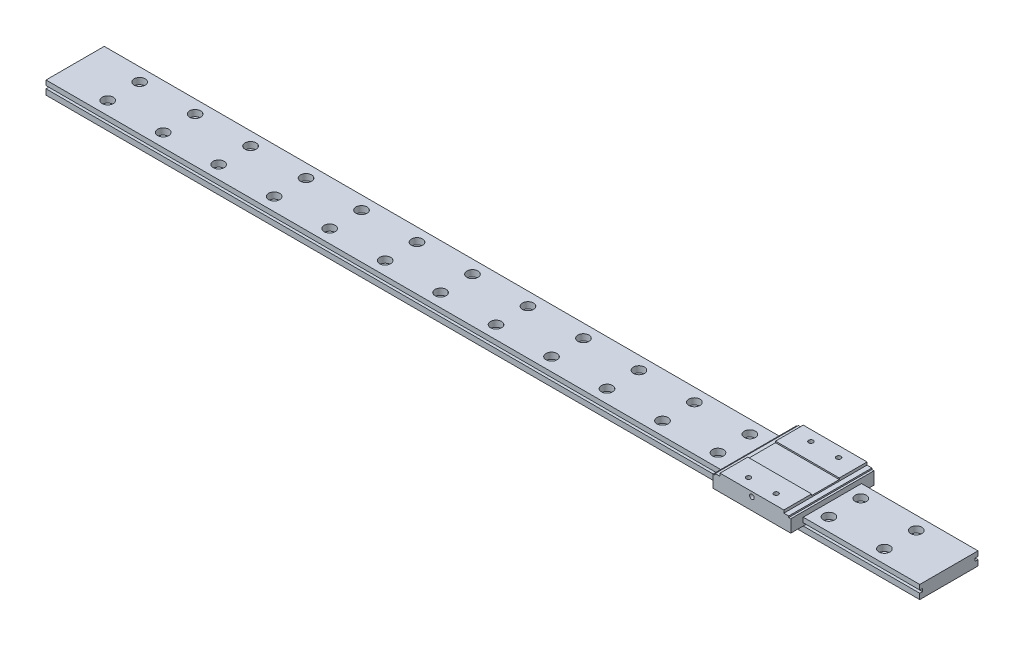
from build123d import *

# Parameters (mm, degrees)
SKETCH_1_W             = 630
SKETCH_1_H             = 42
EXTRUDE_1_DEPTH        = 9.5
SKETCH_2_R             = 4
CUT_EXTRUDE_1_DEPTH    = 4.5
SKETCH_3_R             = 2.25
CUT_EXTRUDE_2_DEPTH    = 632.418244906
SKETCH_16_W            = 5.144238896
SKETCH_16_H            = 2
SKETCH_16_W_2          = 7.201213672
CUT_EXTRUDE_6_DEPTH    = 632.469912189
SKETCH_6_W             = 56
SKETCH_6_H             = 60
EXTRUDE_2_DEPTH        = 12
HOLE_WIZARD_M4_1_D     = 3.3
HOLE_WIZARD_M4_1_DEPTH = 7
HOLE_WIZARD_M4_1_TIP   = 0.991420021
SKETCH_9_W             = 5
SKETCH_9_H             = 60
CUT_EXTRUDE_3_DEPTH    = 2
SKETCH_10_W            = 46
SKETCH_10_H            = 20
CUT_EXTRUDE_4_DEPTH    = 1
SKETCH_11_W            = 1.5
SKETCH_11_H            = 60
CUT_EXTRUDE_5_DEPTH    = 1
HOLE_WIZARD_M4_2_D     = 3.3


with BuildPart() as part:
    # 스케치1 → 보스-돌출1 (new body)
    with BuildSketch(Plane(origin=(0, 0, 0), x_dir=(1, 0, 0), z_dir=(0, 1, 0))):
        with Locations((315, 21)):
            Rectangle(SKETCH_1_W, SKETCH_1_H)
    extrude(amount=EXTRUDE_1_DEPTH)

    # 스케치2 → 컷-돌출1 (cut)
    with BuildSketch(Plane(origin=(0, 9.5, 0), x_dir=(1, 0, 0), z_dir=(0, 1, 0))):
        with Locations(Location((35, 32.5, 0), (0, 0, 270))):
            Circle(SKETCH_2_R)
        with Locations(Location((35, 9.5, 0), (0, 0, 270))):
            Circle(SKETCH_2_R)
        with Locations(Location((75, 32.5, 0), (0, 0, 270))):
            Circle(SKETCH_2_R)
        with Locations(Location((75, 9.5, 0), (0, 0, 270))):
            Circle(SKETCH_2_R)
        with Locations(Location((115, 32.5, 0), (0, 0, 270))):
            Circle(SKETCH_2_R)
        with Locations(Location((115, 9.5, 0), (0, 0, 270))):
            Circle(SKETCH_2_R)
        with Locations(Location((155, 32.5, 0), (0, 0, 270))):
            Circle(SKETCH_2_R)
        with Locations(Location((155, 9.5, 0), (0, 0, 270))):
            Circle(SKETCH_2_R)
        with Locations(Location((195, 32.5, 0), (0, 0, 270))):
            Circle(SKETCH_2_R)
        with Locations(Location((195, 9.5, 0), (0, 0, 270))):
            Circle(SKETCH_2_R)
        with Locations(Location((235, 32.5, 0), (0, 0, 270))):
            Circle(SKETCH_2_R)
        with Locations(Location((235, 9.5, 0), (0, 0, 270))):
            Circle(SKETCH_2_R)
        with Locations(Location((275, 32.5, 0), (0, 0, 270))):
            Circle(SKETCH_2_R)
        with Locations(Location((275, 9.5, 0), (0, 0, 270))):
            Circle(SKETCH_2_R)
        with Locations(Location((315, 32.5, 0), (0, 0, 270))):
            Circle(SKETCH_2_R)
        with Locations(Location((315, 9.5, 0), (0, 0, 270))):
            Circle(SKETCH_2_R)
        with Locations(Location((355, 32.5, 0), (0, 0, 270))):
            Circle(SKETCH_2_R)
        with Locations(Location((355, 9.5, 0), (0, 0, 270))):
            Circle(SKETCH_2_R)
        with Locations(Location((395, 32.5, 0), (0, 0, 270))):
            Circle(SKETCH_2_R)
        with Locations(Location((395, 9.5, 0), (0, 0, 270))):
            Circle(SKETCH_2_R)
        with Locations(Location((435, 32.5, 0), (0, 0, 270))):
            Circle(SKETCH_2_R)
        with Locations(Location((435, 9.5, 0), (0, 0, 270))):
            Circle(SKETCH_2_R)
        with Locations(Location((475, 32.5, 0), (0, 0, 270))):
            Circle(SKETCH_2_R)
        with Locations(Location((475, 9.5, 0), (0, 0, 270))):
            Circle(SKETCH_2_R)
        with Locations(Location((515, 32.5, 0), (0, 0, 270))):
            Circle(SKETCH_2_R)
        with Locations(Location((515, 9.5, 0), (0, 0, 270))):
            Circle(SKETCH_2_R)
        with Locations(Location((555, 32.5, 0), (0, 0, 270))):
            Circle(SKETCH_2_R)
        with Locations(Location((555, 9.5, 0), (0, 0, 270))):
            Circle(SKETCH_2_R)
        with Locations(Location((595, 32.5, 0), (0, 0, 270))):
            Circle(SKETCH_2_R)
        with Locations(Location((595, 9.5, 0), (0, 0, 270))):
            Circle(SKETCH_2_R)
    extrude(amount=-CUT_EXTRUDE_1_DEPTH, mode=Mode.SUBTRACT)

    # 스케치3 → 컷-돌출2 (cut, through all)
    with BuildSketch(Plane(origin=(0, 5, 0), x_dir=(1, 0, 0), z_dir=(0, 1, 0))):
        with Locations(Location((35, 32.5, 0), (0, 0, 270))):
            Circle(SKETCH_3_R)
        with Locations(Location((35, 9.5, 0), (0, 0, 270))):
            Circle(SKETCH_3_R)
        with Locations(Location((75, 32.5, 0), (0, 0, 270))):
            Circle(SKETCH_3_R)
        with Locations(Location((75, 9.5, 0), (0, 0, 270))):
            Circle(SKETCH_3_R)
        with Locations(Location((115, 32.5, 0), (0, 0, 270))):
            Circle(SKETCH_3_R)
        with Locations(Location((115, 9.5, 0), (0, 0, 270))):
            Circle(SKETCH_3_R)
        with Locations(Location((155, 32.5, 0), (0, 0, 270))):
            Circle(SKETCH_3_R)
        with Locations(Location((155, 9.5, 0), (0, 0, 270))):
            Circle(SKETCH_3_R)
        with Locations(Location((195, 32.5, 0), (0, 0, 270))):
            Circle(SKETCH_3_R)
        with Locations(Location((195, 9.5, 0), (0, 0, 270))):
            Circle(SKETCH_3_R)
        with Locations(Location((235, 32.5, 0), (0, 0, 270))):
            Circle(SKETCH_3_R)
        with Locations(Location((235, 9.5, 0), (0, 0, 270))):
            Circle(SKETCH_3_R)
        with Locations(Location((275, 32.5, 0), (0, 0, 270))):
            Circle(SKETCH_3_R)
        with Locations(Location((275, 9.5, 0), (0, 0, 270))):
            Circle(SKETCH_3_R)
        with Locations(Location((315, 32.5, 0), (0, 0, 270))):
            Circle(SKETCH_3_R)
        with Locations(Location((315, 9.5, 0), (0, 0, 270))):
            Circle(SKETCH_3_R)
        with Locations(Location((355, 32.5, 0), (0, 0, 270))):
            Circle(SKETCH_3_R)
        with Locations(Location((355, 9.5, 0), (0, 0, 270))):
            Circle(SKETCH_3_R)
        with Locations(Location((395, 32.5, 0), (0, 0, 270))):
            Circle(SKETCH_3_R)
        with Locations(Location((395, 9.5, 0), (0, 0, 270))):
            Circle(SKETCH_3_R)
        with Locations(Location((435, 32.5, 0), (0, 0, 270))):
            Circle(SKETCH_3_R)
        with Locations(Location((435, 9.5, 0), (0, 0, 270))):
            Circle(SKETCH_3_R)
        with Locations(Location((475, 32.5, 0), (0, 0, 270))):
            Circle(SKETCH_3_R)
        with Locations(Location((475, 9.5, 0), (0, 0, 270))):
            Circle(SKETCH_3_R)
        with Locations(Location((515, 32.5, 0), (0, 0, 270))):
            Circle(SKETCH_3_R)
        with Locations(Location((515, 9.5, 0), (0, 0, 270))):
            Circle(SKETCH_3_R)
        with Locations(Location((555, 32.5, 0), (0, 0, 270))):
            Circle(SKETCH_3_R)
        with Locations(Location((555, 9.5, 0), (0, 0, 270))):
            Circle(SKETCH_3_R)
        with Locations(Location((595, 32.5, 0), (0, 0, 270))):
            Circle(SKETCH_3_R)
        with Locations(Location((595, 9.5, 0), (0, 0, 270))):
            Circle(SKETCH_3_R)
    extrude(amount=-CUT_EXTRUDE_2_DEPTH, mode=Mode.SUBTRACT)

    # 스케치16 → 컷-돌출6 (cut, through all)
    with BuildSketch(Plane(origin=(630, 0, 0), x_dir=(0, 0, -1), z_dir=(1, 0, 0))):
        with Locations((-0.572119448, 5)):
            Rectangle(SKETCH_16_W, SKETCH_16_H)
        with Locations((43.600606836, 5)):
            Rectangle(SKETCH_16_W_2, SKETCH_16_H)
    extrude(amount=-CUT_EXTRUDE_6_DEPTH, mode=Mode.SUBTRACT)

    # 스케치6 → 보스-돌출2 (add)
    with BuildSketch(Plane(origin=(0, 4, 0), x_dir=(-1, 0, 0), z_dir=(0, -1, 0))):
        with Locations((-518, 21)):
            Rectangle(SKETCH_6_W, SKETCH_6_H)
    extrude(amount=-EXTRUDE_2_DEPTH)

    # M4 나사 구멍1
    with Locations(Plane(origin=(0, 16, 0), x_dir=(1, 0, 0), z_dir=(0, 1, 0))):
        with Locations((508, 43.5), (528, 43.5), (508, -1.5), (528, -1.5)):
            Hole(HOLE_WIZARD_M4_1_D / 2, depth=HOLE_WIZARD_M4_1_DEPTH)
            with Locations((0, 0, -(HOLE_WIZARD_M4_1_DEPTH + HOLE_WIZARD_M4_1_TIP / 2))):  # 118° drill point
                Cone(0, HOLE_WIZARD_M4_1_D / 2, HOLE_WIZARD_M4_1_TIP, mode=Mode.SUBTRACT)

    # 스케치9 → 컷-돌출3 (cut)
    with BuildSketch(Plane(origin=(0, 16, 0), x_dir=(1, 0, 0), z_dir=(0, 1, 0))):
        with Locations((492.5, 21)):
            Rectangle(SKETCH_9_W, SKETCH_9_H)
        with Locations((543.5, 21)):
            Rectangle(SKETCH_9_W, SKETCH_9_H)
    extrude(amount=-CUT_EXTRUDE_3_DEPTH, mode=Mode.SUBTRACT)

    # 스케치10 → 컷-돌출4 (cut)
    with BuildSketch(Plane(origin=(0, 16, 0), x_dir=(1, 0, 0), z_dir=(0, 1, 0))):
        with Locations((518, 21)):
            Rectangle(SKETCH_10_W, SKETCH_10_H)
    extrude(amount=-CUT_EXTRUDE_4_DEPTH, mode=Mode.SUBTRACT)

    # 스케치11 → 컷-돌출5 (cut)
    with BuildSketch(Plane(origin=(0, 14, 0), x_dir=(1, 0, 0), z_dir=(0, 1, 0))):
        with Locations((545.25, 21)):
            Rectangle(SKETCH_11_W, SKETCH_11_H)
        with Locations((490.75, 21)):
            Rectangle(SKETCH_11_W, SKETCH_11_H)
    extrude(amount=-CUT_EXTRUDE_5_DEPTH, mode=Mode.SUBTRACT)

    # M4 나사 구멍2 (through all)
    with Locations(Plane.XY.offset(9)):
        with Locations((518, 12.75)):
            Hole(HOLE_WIZARD_M4_2_D / 2)


solid = part.part
